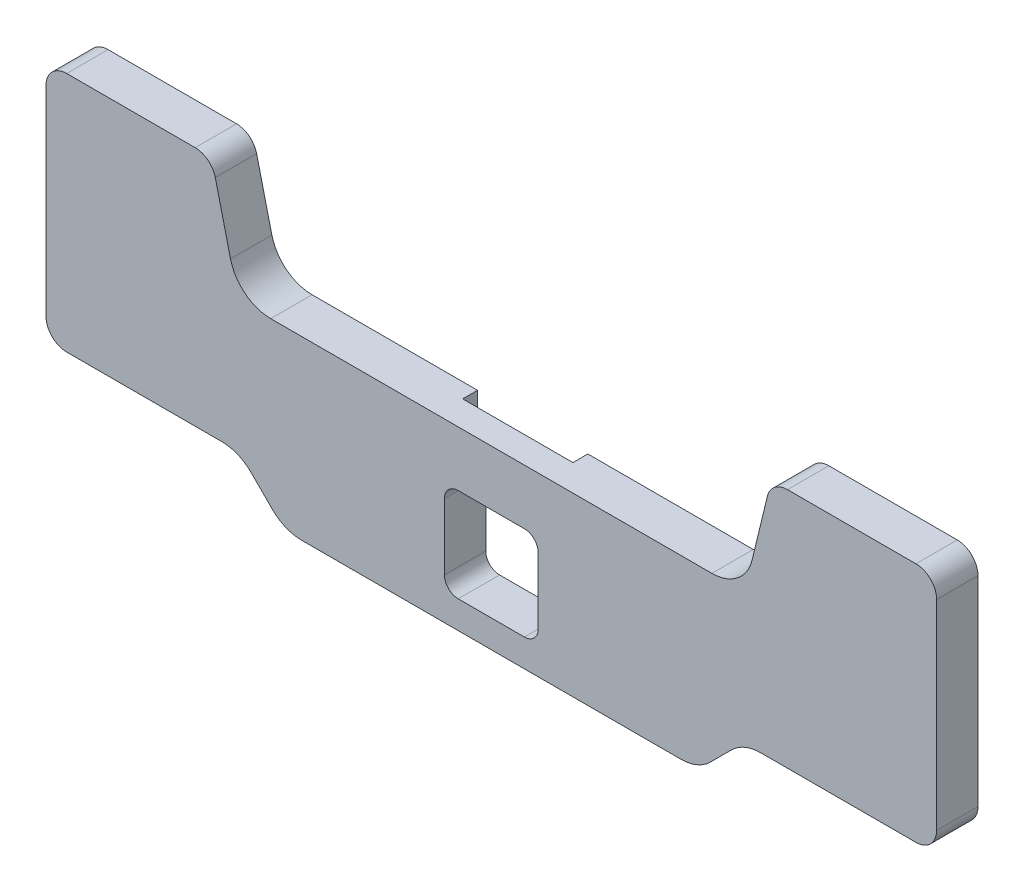
from build123d import *

# Parameters (mm, degrees)
EXTRUDE_1_DEPTH     = 30
FILLET_1_R          = 15
FILLET_2_R          = 30
CUT_EXTRUDE_1_DEPTH = 30
CUT_EXTRUDE_2_DEPTH = 40


with BuildPart() as part:
    # 草图1 → 凸台-拉伸1 (new body)
    with BuildSketch(Plane.XY):
        with BuildLine():
            Line((-323, 208), (-323, 33))
            Line((-323, 33), (-183, 33))
            Line((-183, 33), (-150, 0))
            Line((-150, 0), (150, 0))
            Line((150, 0), (183, 33))
            Line((183, 33), (323, 33))
            Line((323, 33), (323, 208))
            Line((323, 208), (203, 208))
            Line((203, 208), (189.154352992, 150.927256427))
            ThreePointArc((189.154352992, 150.927256427), (178.544779492, 134.418414947), (160, 128))
            Line((160, 128), (-160, 128))
            ThreePointArc((-160, 128), (-178.544779492, 134.418414947), (-189.154352992, 150.927256427))
            Line((-189.154352992, 150.927256427), (-203, 208))
            Line((-203, 208), (-323, 208))
        make_face()
    extrude(amount=EXTRUDE_1_DEPTH)

    # 圆角1
    fillet_1_edges = [part.edges().sort_by_distance(p)[0] for p in [
        (-203, 208, 15),
        (203, 208, 15),
        (323, 208, 15),
        (323, 33, 15),
        (-323, 33, 15),
        (-323, 208, 15),
    ]]
    fillet(fillet_1_edges, radius=FILLET_1_R)

    # 圆角2
    fillet_2_edges = [part.edges().sort_by_distance(p)[0] for p in [
        (183, 33, 15),
        (150, 0, 15),
        (-150, 0, 15),
        (-183, 33, 15),
    ]]
    fillet(fillet_2_edges, radius=FILLET_2_R)

    # 草图2 → 切除-拉伸1 (cut)
    with BuildSketch(Plane.XY.offset(30)):
        with BuildLine():
            Line((-24, 88), (24, 88))
            ThreePointArc((24, 88), (31.071067812, 85.071067812), (34, 78))
            Line((34, 78), (34, 30))
            ThreePointArc((34, 30), (31.071067812, 22.928932188), (24, 20))
            Line((24, 20), (-24, 20))
            ThreePointArc((-24, 20), (-31.071067812, 22.928932188), (-34, 30))
            Line((-34, 30), (-34, 78))
            ThreePointArc((-34, 78), (-31.071067812, 85.071067812), (-24, 88))
        make_face()
    extrude(amount=-CUT_EXTRUDE_1_DEPTH, mode=Mode.SUBTRACT)

    # 草图3 → 切除-拉伸2 (cut, symmetric)
    with BuildSketch(Plane(origin=(0, 0, 0), x_dir=(0, 0, -1), z_dir=(1, 0, 0))):
        Polygon((0, 130), (-12, 130), (0, 110), align=None)
    extrude(amount=CUT_EXTRUDE_2_DEPTH, both=True, mode=Mode.SUBTRACT)


solid = part.part
